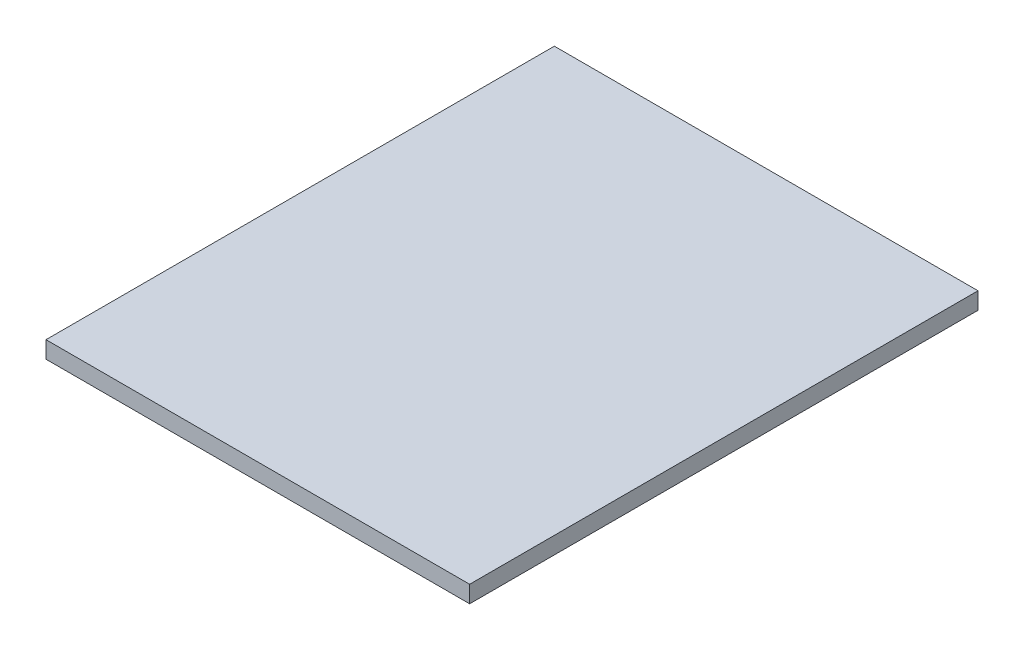
from build123d import *

# Parameters (mm, degrees)
SKETCH1_W           = 1000
SKETCH1_H           = 1200
BOSS_EXTRUDE1_DEPTH = 40


with BuildPart() as part:
    # Sketch1 → Boss-Extrude1 (new body)
    with BuildSketch(Plane(origin=(0, 0, 0), x_dir=(1, 0, 0), z_dir=(0, 1, 0))):
        Rectangle(SKETCH1_W, SKETCH1_H)
    extrude(amount=BOSS_EXTRUDE1_DEPTH)


solid = part.part
